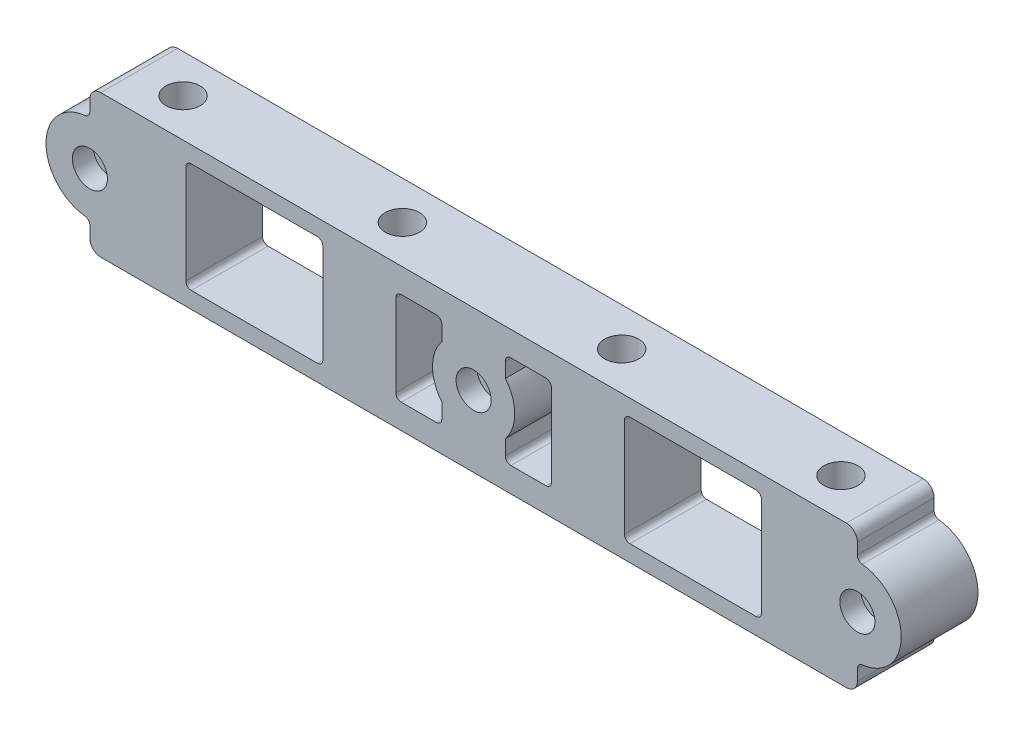
from build123d import *

# Parameters (mm, degrees)
SKETCH1_W           = 203.2
SKETCH1_H           = 17.78
SKETCH1_R           = 3.96875
BOSS_EXTRUDE1_DEPTH = 33.02
SKETCH2_R           = 2.4892
CUT_EXTRUDE1_DEPTH  = 17.78
SKETCH3_R           = 4.064
CUT_EXTRUDE2_DEPTH  = 4.826
CUT_EXTRUDE3_DEPTH  = 17.78
CUT_EXTRUDE4_DEPTH  = 17.78
FILLET1_R           = 2.54


with BuildPart() as part:
    # Sketch1 → Boss-Extrude1 (new body)
    with BuildSketch(Plane(origin=(0, 0, 0), x_dir=(1, 0, 0), z_dir=(0, 1, 0))):
        with Locations((0, 8.89)):
            Rectangle(SKETCH1_W, SKETCH1_H)
        with Locations(Location((76.2, 8.89, 0), (0, 0, 270))):
            Circle(SKETCH1_R, mode=Mode.SUBTRACT)
        with Locations(Location((25.4, 8.89, 0), (0, 0, 270))):
            Circle(SKETCH1_R, mode=Mode.SUBTRACT)
        with Locations(Location((-25.4, 8.89, 0), (0, 0, 270))):
            Circle(SKETCH1_R, mode=Mode.SUBTRACT)
        with Locations(Location((-76.2, 8.89, 0), (0, 0, 270))):
            Circle(SKETCH1_R, mode=Mode.SUBTRACT)
    extrude(amount=-BOSS_EXTRUDE1_DEPTH)

    # Sketch2 → Cut-Extrude1 (cut)
    with BuildSketch(Plane.XY):
        with Locations((88.9, -16.51)):
            Circle(SKETCH2_R)
        with Locations((0, -16.51)):
            Circle(SKETCH2_R)
        with Locations((-88.9, -16.51)):
            Circle(SKETCH2_R)
    extrude(amount=-CUT_EXTRUDE1_DEPTH, mode=Mode.SUBTRACT)

    # Sketch3 → Cut-Extrude2 (cut)
    with BuildSketch(Plane.XY):
        with Locations((88.9, -16.51)):
            Circle(SKETCH3_R)
        with Locations((0, -16.51)):
            Circle(SKETCH3_R)
        with Locations((-88.9, -16.51)):
            Circle(SKETCH3_R)
    extrude(amount=-CUT_EXTRUDE2_DEPTH, mode=Mode.SUBTRACT)

    # Sketch4 → Cut-Extrude3 (cut)
    with BuildSketch(Plane.XY):
        with BuildLine():
            Line((-36.195, -29.21), (-65.405, -29.21))
            ThreePointArc((-65.405, -29.21), (-66.303025612, -28.838025612), (-66.675, -27.94))
            Line((-66.675, -27.94), (-66.675, -5.08))
            ThreePointArc((-66.675, -5.08), (-66.303025612, -4.181974388), (-65.405, -3.81))
            Line((-65.405, -3.81), (-36.195, -3.81))
            ThreePointArc((-36.195, -3.81), (-35.296974388, -4.181974388), (-34.925, -5.08))
            Line((-34.925, -5.08), (-34.925, -27.94))
            ThreePointArc((-34.925, -27.94), (-35.296974388, -28.838025612), (-36.195, -29.21))
        make_face()
        with BuildLine():
            Line((-8.636, -27.305), (-16.764, -27.305))
            ThreePointArc((-16.764, -27.305), (-17.662025612, -26.933025612), (-18.034, -26.035))
            Line((-18.034, -26.035), (-18.034, -6.985))
            ThreePointArc((-18.034, -6.985), (-17.662025612, -6.086974388), (-16.764, -5.715))
            Line((-16.764, -5.715), (-8.636, -5.715))
            ThreePointArc((-8.636, -5.715), (-7.737974388, -6.086974388), (-7.366, -6.985))
            Line((-7.366, -6.985), (-7.366, -10.471153339))
            ThreePointArc((-7.366, -10.471153339), (-9.525, -16.51), (-7.366, -22.548846661))
            Line((-7.366, -22.548846661), (-7.366, -26.035))
            ThreePointArc((-7.366, -26.035), (-7.737974388, -26.933025612), (-8.636, -27.305))
        make_face()
        with BuildLine():
            Line((36.195, -3.81), (65.405, -3.81))
            ThreePointArc((65.405, -3.81), (66.303025612, -4.181974388), (66.675, -5.08))
            Line((66.675, -5.08), (66.675, -27.94))
            ThreePointArc((66.675, -27.94), (66.303025612, -28.838025612), (65.405, -29.21))
            Line((65.405, -29.21), (36.195, -29.21))
            ThreePointArc((36.195, -29.21), (35.296974388, -28.838025612), (34.925, -27.94))
            Line((34.925, -27.94), (34.925, -5.08))
            ThreePointArc((34.925, -5.08), (35.296974388, -4.181974388), (36.195, -3.81))
        make_face()
        with BuildLine():
            Line((7.366, -26.035), (7.366, -22.548846661))
            ThreePointArc((7.366, -22.548846661), (9.525, -16.51), (7.366, -10.471153339))
            Line((7.366, -10.471153339), (7.366, -6.985))
            ThreePointArc((7.366, -6.985), (7.737974388, -6.086974388), (8.636, -5.715))
            Line((8.636, -5.715), (16.764, -5.715))
            ThreePointArc((16.764, -5.715), (17.662025612, -6.086974388), (18.034, -6.985))
            Line((18.034, -6.985), (18.034, -26.035))
            ThreePointArc((18.034, -26.035), (17.662025612, -26.933025612), (16.764, -27.305))
            Line((16.764, -27.305), (8.636, -27.305))
            ThreePointArc((8.636, -27.305), (7.737974388, -26.933025612), (7.366, -26.035))
        make_face()
    extrude(amount=-CUT_EXTRUDE3_DEPTH, mode=Mode.SUBTRACT)

    # Sketch5 → Cut-Extrude4 (cut)
    with BuildSketch(Plane.XY):
        with BuildLine():
            Line((88.9, -27.869225326), (88.9, -33.02))
            Line((88.9, -33.02), (101.6, -33.02))
            Line((101.6, -33.02), (101.6, 0))
            Line((101.6, 0), (88.9, 0))
            Line((88.9, 0), (88.9, -5.150774674))
            ThreePointArc((88.9, -5.150774674), (89.22339789, -5.997441341), (90.028888889, -6.412910822))
            ThreePointArc((90.028888889, -6.412910822), (99.06, -16.51), (90.028888889, -26.607089178))
            ThreePointArc((90.028888889, -26.607089178), (89.22339789, -27.022558659), (88.9, -27.869225326))
        make_face()
        with BuildLine():
            Line((-88.9, -5.150774674), (-88.9, 0))
            Line((-88.9, 0), (-101.6, 0))
            Line((-101.6, 0), (-101.6, -33.02))
            Line((-101.6, -33.02), (-88.9, -33.02))
            Line((-88.9, -33.02), (-88.9, -27.869225326))
            ThreePointArc((-88.9, -27.869225326), (-89.22339789, -27.022558659), (-90.028888889, -26.607089178))
            ThreePointArc((-90.028888889, -26.607089178), (-99.06, -16.51), (-90.028888889, -6.412910822))
            ThreePointArc((-90.028888889, -6.412910822), (-89.22339789, -5.997441341), (-88.9, -5.150774674))
        make_face()
    extrude(amount=-CUT_EXTRUDE4_DEPTH, mode=Mode.SUBTRACT)

    # Fillet1
    fillet1_edges = [part.edges().sort_by_distance(p)[0] for p in [
        (88.9, 0, -8.89),
        (88.9, -33.02, -8.89),
        (-88.9, 0, -8.89),
        (-88.9, -33.02, -8.89),
    ]]
    fillet(fillet1_edges, radius=FILLET1_R)


solid = part.part
